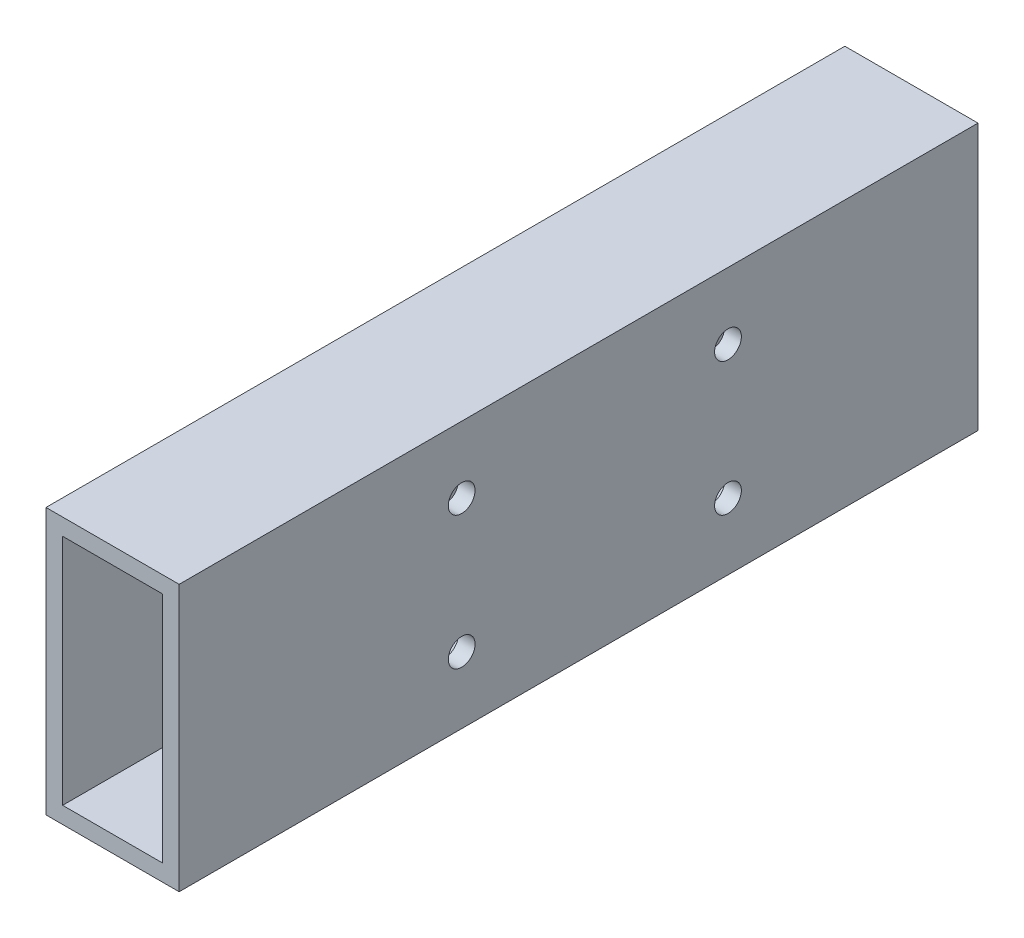
from build123d import *

# Parameters (mm, degrees)
SKETCH1_W              = 25.4
SKETCH1_H              = 50.8
SKETCH1_W_2            = 19.05
SKETCH1_H_2            = 44.45
BOSS_EXTRUDE1_DEPTH    = 76.2
F_10_CLEARANCE_HOLE1_D = 5.1054


with BuildPart() as part:
    # Sketch1 → Boss-Extrude1 (new, symmetric)
    with BuildSketch(Plane.XY):
        Rectangle(SKETCH1_W, SKETCH1_H)
        Rectangle(SKETCH1_W_2, SKETCH1_H_2, mode=Mode.SUBTRACT)
    extrude(amount=BOSS_EXTRUDE1_DEPTH, both=True)

    # #10 Clearance Hole1 (through all)
    with Locations(Plane(origin=(12.7, 0, 0), x_dir=(0, 0, -1), z_dir=(1, 0, 0))):
        with Locations((-22.298769885, 12.7), (28.501230115, 12.7), (28.501230115, -12.7), (-22.298769885, -12.7)):
            Hole(F_10_CLEARANCE_HOLE1_D / 2)


solid = part.part
